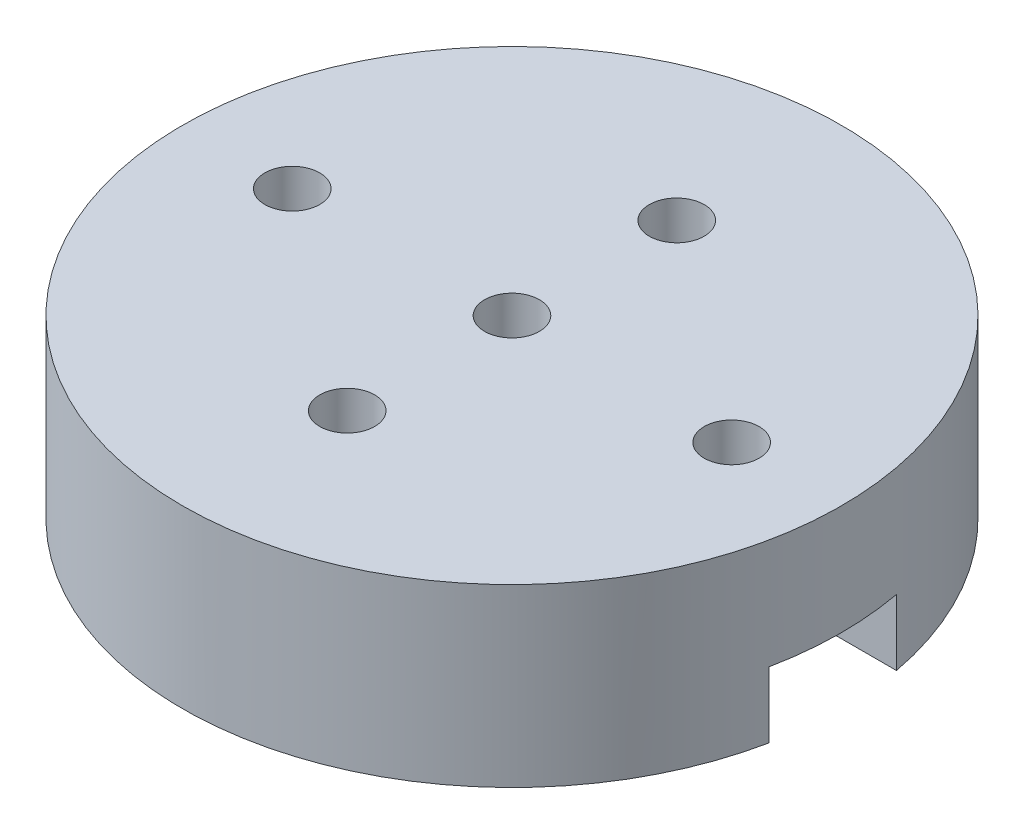
from build123d import *

# Parameters (mm, degrees)
SKETCH4_R           = 60
BOSS_EXTRUDE2_DEPTH = 32
CUT_EXTRUDE1_DEPTH  = 12
CUT_EXTRUDE2_DEPTH  = 12
SKETCH4_18_R        = 5
CUT_EXTRUDE6_DEPTH  = 12
SKETCH4_19_R        = 5
CUT_EXTRUDE7_DEPTH  = 40
SKETCH4_20_R        = 5
CUT_EXTRUDE8_DEPTH  = 40
SKETCH4_21_R        = 5
CUT_EXTRUDE9_DEPTH  = 40
SKETCH4_22_R        = 5
CUT_EXTRUDE10_DEPTH = 40
SKETCH4_23_R        = 5
CUT_EXTRUDE11_DEPTH = 40


with BuildPart() as part:
    # Sketch4 → Boss-Extrude2 (new body)
    with BuildSketch(Plane(origin=(0, 0, 0), x_dir=(1, 0, 0), z_dir=(0, 1, 0))):
        Circle(SKETCH4_R)
    extrude(amount=BOSS_EXTRUDE2_DEPTH)

    # Sketch4<4> → Cut-Extrude1 (cut)
    with BuildSketch(Plane(origin=(0, 0, 0), x_dir=(1, 0, 0), z_dir=(0, 1, 0))):
        with BuildLine():
            ThreePointArc((24.954792471, 43.222968452), (0, 49.909584942), (-24.954792471, 43.222968452))
            ThreePointArc((-24.954792471, 43.222968452), (-26.052868682, 39.124892241), (-21.954792471, 38.026816029))
            ThreePointArc((-21.954792471, 38.026816029), (0, 43.909584942), (21.954792471, 38.026816029))
            ThreePointArc((21.954792471, 38.026816029), (26.052868682, 39.124892241), (24.954792471, 43.222968452))
        make_face()
    extrude(amount=CUT_EXTRUDE1_DEPTH, mode=Mode.SUBTRACT)

    # Sketch4<5> → Cut-Extrude2 (cut)
    with BuildSketch(Plane(origin=(0, 0, 0), x_dir=(1, 0, 0), z_dir=(0, 1, 0))):
        with BuildLine():
            ThreePointArc((24.954792471, -43.222968452), (0, -49.909584942), (-24.954792471, -43.222968452))
            ThreePointArc((-24.954792471, -43.222968452), (-26.052868682, -39.124892241), (-21.954792471, -38.026816029))
            ThreePointArc((-21.954792471, -38.026816029), (0, -43.909584942), (21.954792471, -38.026816029))
            ThreePointArc((21.954792471, -38.026816029), (26.052868682, -39.124892241), (24.954792471, -43.222968452))
        make_face()
    extrude(amount=CUT_EXTRUDE2_DEPTH, mode=Mode.SUBTRACT)

    # Sketch4<18> → Cut-Extrude6 (cut)
    with BuildSketch(Plane(origin=(0, 0, 0), x_dir=(1, 0, 0), z_dir=(0, 1, 0))):
        with BuildLine():
            ThreePointArc((60, 0), (59.74389008, 5.537833341), (58.97774673, 11.028390213))
            Line((58.97774673, 11.028390213), (12, 11.028390213))
            Line((12, 11.028390213), (12, 25))
            ThreePointArc((12, 25), (0, 37), (-12, 25))
            Line((-12, 25), (-12, 11.028390213))
            Line((-12, 11.028390213), (-58.97774673, 11.028390213))
            ThreePointArc((-58.97774673, 11.028390213), (-59.997958043, -0.495005778), (-58.787753827, -12))
            Line((-58.787753827, -12), (-12, -12))
            Line((-12, -12), (-12, -25))
            ThreePointArc((-12, -25), (0, -37), (12, -25))
            Line((12, -25), (12, -12))
            Line((12, -12), (58.787753827, -12))
            ThreePointArc((58.787753827, -12), (58.795548236, -11.961751865), (58.80331776, -11.923498667))
            ThreePointArc((58.80331776, -11.923498667), (59.700079839, -5.99169986), (60, 0))
        make_face()
        with Locations((0, -30)):
            Circle(SKETCH4_18_R, mode=Mode.SUBTRACT)
        with Locations((-40, 0)):
            Circle(SKETCH4_18_R, mode=Mode.SUBTRACT)
        with BuildLine():
            ThreePointArc((0, 5), (3.535533906, 3.535533906), (5, 0))
            ThreePointArc((5, 0), (-3.535533906, -3.535533906), (0, 5))
        make_face(mode=Mode.SUBTRACT)
        with Locations((40, 0)):
            Circle(SKETCH4_18_R, mode=Mode.SUBTRACT)
        with Locations((0, 30)):
            Circle(SKETCH4_18_R, mode=Mode.SUBTRACT)
    extrude(amount=CUT_EXTRUDE6_DEPTH, mode=Mode.SUBTRACT)

    # Sketch4<19> → Cut-Extrude7 (cut)
    with BuildSketch(Plane(origin=(0, 0, 0), x_dir=(1, 0, 0), z_dir=(0, 1, 0))):
        with Locations((0, -30)):
            Circle(SKETCH4_19_R)
    extrude(amount=CUT_EXTRUDE7_DEPTH, mode=Mode.SUBTRACT)

    # Sketch4<20> → Cut-Extrude8 (cut)
    with BuildSketch(Plane(origin=(0, 0, 0), x_dir=(1, 0, 0), z_dir=(0, 1, 0))):
        with Locations((-40, 0)):
            Circle(SKETCH4_20_R)
    extrude(amount=CUT_EXTRUDE8_DEPTH, mode=Mode.SUBTRACT)

    # Sketch4<21> → Cut-Extrude9 (cut)
    with BuildSketch(Plane(origin=(0, 0, 0), x_dir=(1, 0, 0), z_dir=(0, 1, 0))):
        Circle(SKETCH4_21_R)
    extrude(amount=CUT_EXTRUDE9_DEPTH, mode=Mode.SUBTRACT)

    # Sketch4<22> → Cut-Extrude10 (cut)
    with BuildSketch(Plane(origin=(0, 0, 0), x_dir=(1, 0, 0), z_dir=(0, 1, 0))):
        with Locations((40, 0)):
            Circle(SKETCH4_22_R)
    extrude(amount=CUT_EXTRUDE10_DEPTH, mode=Mode.SUBTRACT)

    # Sketch4<23> → Cut-Extrude11 (cut)
    with BuildSketch(Plane(origin=(0, 0, 0), x_dir=(1, 0, 0), z_dir=(0, 1, 0))):
        with Locations((0, 30)):
            Circle(SKETCH4_23_R)
    extrude(amount=CUT_EXTRUDE11_DEPTH, mode=Mode.SUBTRACT)


solid = part.part
